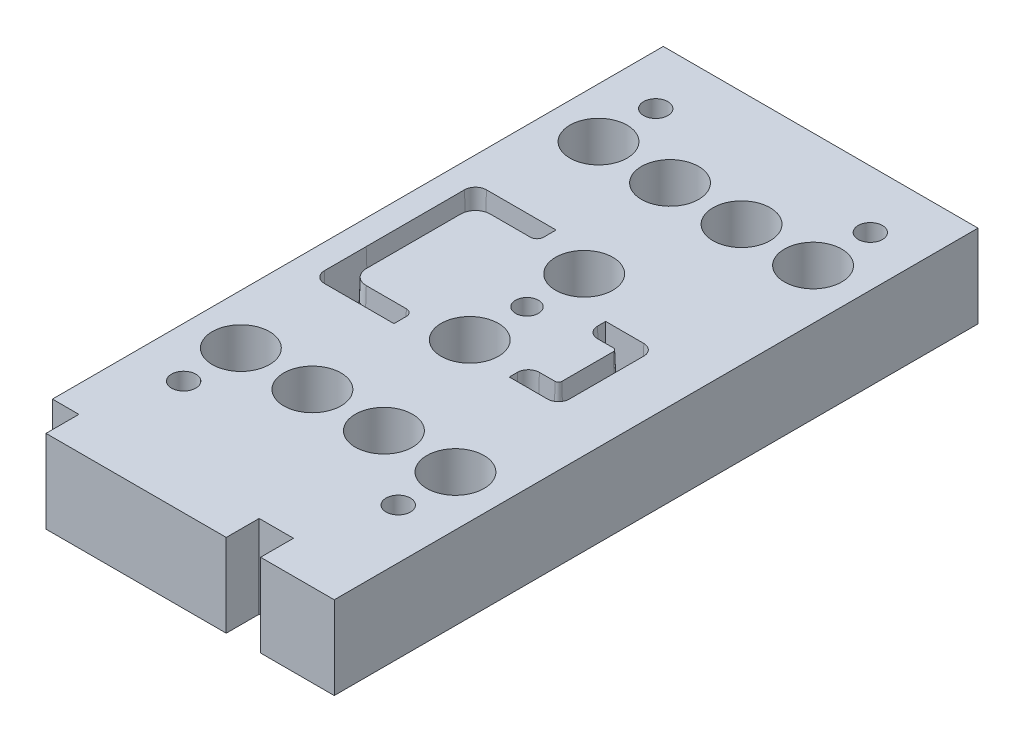
from build123d import *

# Parameters (mm, degrees)
SKETCH1_W           = 110
SKETCH1_H           = 225
BOSS_EXTRUDE1_DEPTH = 29
CUT_EXTRUDE1_REACH  = 130.539
CUT_EXTRUDE2_REACH  = 130.539
SKETCH4_R           = 8.5
CUT_EXTRUDE3_DEPTH  = 5
SKETCH5_R           = 10
CUT_EXTRUDE4_DEPTH  = 20
CUT_EXTRUDE5_REACH  = 130.539
SKETCH6_W           = 12
SKETCH6_H           = 11.5
M10_TAPPED_HOLE1_D  = 8.5
CUT_EXTRUDE6_REACH  = 130.539
SKETCH10_R          = 4


with BuildPart() as part:
    # Sketch1 → Boss-Extrude1 (new body)
    with BuildSketch(Plane(origin=(0, 0, 0), x_dir=(1, 0, 0), z_dir=(0, 1, 0))):
        Rectangle(SKETCH1_W, SKETCH1_H)
    extrude(amount=-BOSS_EXTRUDE1_DEPTH)

    # Sketch2 → Cut-Extrude1 (cut, up to next)
    with BuildSketch(Plane(origin=(0, 0, 0), x_dir=(1, 0, 0), z_dir=(0, 1, 0)), mode=Mode.PRIVATE) as cut_extrude1_sk1:
        with BuildLine():
            Line((-19, 37.36), (-19, 33.86))
            ThreePointArc((-19, 33.86), (-19.439339828, 32.799339828), (-20.5, 32.36))
            Line((-20.5, 32.36), (-34.5, 32.36))
            ThreePointArc((-34.5, 32.36), (-38.742640687, 30.602640687), (-40.5, 26.36))
            Line((-40.5, 26.36), (-40.5, -6.64))
            ThreePointArc((-40.5, -6.64), (-38.742640687, -10.882640687), (-34.5, -12.64))
            Line((-34.5, -12.64), (-20.5, -12.64))
            ThreePointArc((-20.5, -12.64), (-19.439339828, -13.079339828), (-19, -14.14))
            Line((-19, -14.14), (-19, -17.64))
            Line((-19, -17.64), (-42.5, -17.64))
            ThreePointArc((-42.5, -17.64), (-44.621320344, -16.761320344), (-45.5, -14.64))
            Line((-45.5, -14.64), (-45.5, 34.36))
            ThreePointArc((-45.5, 34.36), (-44.621320344, 36.481320344), (-42.5, 37.36))
            Line((-42.5, 37.36), (-19, 37.36))
        make_face()
    cut_extrude1_tool1 = extrude(cut_extrude1_sk1.sketch, amount=-CUT_EXTRUDE1_REACH, mode=Mode.PRIVATE) & part.part
    add(cut_extrude1_tool1.solids().sort_by_distance((-19.610512, 0, -35.61))[0], mode=Mode.SUBTRACT)

    # Sketch3 → Cut-Extrude2 (cut, up to next)
    with BuildSketch(Plane(origin=(0, 0, 0), x_dir=(1, 0, 0), z_dir=(0, 1, 0)), mode=Mode.PRIVATE) as cut_extrude2_sk1:
        with BuildLine():
            Line((19, 18.36), (31.5, 18.36))
            ThreePointArc((31.5, 18.36), (33.621320344, 17.481320344), (34.5, 15.36))
            Line((34.5, 15.36), (34.5, -10.64))
            ThreePointArc((34.5, -10.64), (33.621320344, -12.761320344), (31.5, -13.64))
            Line((31.5, -13.64), (19, -13.64))
            Line((19, -13.64), (19, -11.64))
            ThreePointArc((19, -11.64), (19.878679656, -9.518679656), (22, -8.64))
            Line((22, -8.64), (27.5, -8.64))
            ThreePointArc((27.5, -8.64), (28.914213562, -8.054213562), (29.5, -6.64))
            Line((29.5, -6.64), (29.5, 11.36))
            ThreePointArc((29.5, 11.36), (28.914213562, 12.774213562), (27.5, 13.36))
            Line((27.5, 13.36), (22, 13.36))
            ThreePointArc((22, 13.36), (19.878679656, 14.238679656), (19, 16.36))
            Line((19, 16.36), (19, 18.36))
        make_face()
    cut_extrude2_tool1 = extrude(cut_extrude2_sk1.sketch, amount=-CUT_EXTRUDE2_REACH, mode=Mode.PRIVATE) & part.part
    add(cut_extrude2_tool1.solids().sort_by_distance((25.25, 0, -18.004437))[0], mode=Mode.SUBTRACT)

    # Sketch4 → Cut-Extrude3 (cut)
    with BuildSketch(Plane.XZ.offset(29)):
        with Locations(Location((0, 100, 0), (0, 0, 270))):
            Circle(SKETCH4_R)
        with Locations(Location((0, -100, 0), (0, 0, 270))):
            Circle(SKETCH4_R)
    extrude(amount=-CUT_EXTRUDE3_DEPTH, mode=Mode.SUBTRACT)

    # Sketch5 → Cut-Extrude4 (cut)
    with BuildSketch(Plane(origin=(0, 0, 0), x_dir=(1, 0, 0), z_dir=(0, 1, 0))):
        with Locations(Location((-37.5, 72.36, 0), (0, 0, 270))):
            Circle(SKETCH5_R)
        with Locations(Location((-12.5, 72.36, 0), (0, 0, 270))):
            Circle(SKETCH5_R)
        with Locations(Location((12.5, 72.36, 0), (0, 0, 270))):
            Circle(SKETCH5_R)
        with Locations(Location((37.5, 72.36, 0), (0, 0, 270))):
            Circle(SKETCH5_R)
        with Locations(Location((37.5, -52.64, 0), (0, 0, 90))):
            Circle(SKETCH5_R)
        with Locations(Location((12.5, -52.64, 0), (0, 0, 90))):
            Circle(SKETCH5_R)
        with Locations(Location((-12.5, -52.64, 0), (0, 0, 90))):
            Circle(SKETCH5_R)
        with Locations(Location((-37.5, -52.64, 0), (0, 0, 90))):
            Circle(SKETCH5_R)
        with Locations(Location((0, 29.86, 0), (0, 0, 270))):
            Circle(SKETCH5_R)
        with Locations(Location((0, -10.14, 0), (0, 0, 270))):
            Circle(SKETCH5_R)
    extrude(amount=-CUT_EXTRUDE4_DEPTH, mode=Mode.SUBTRACT)

    # Sketch6 → Cut-Extrude5 (cut, up to next)
    with BuildSketch(Plane(origin=(0, 0, 0), x_dir=(1, 0, 0), z_dir=(0, 1, 0)), mode=Mode.PRIVATE) as cut_extrude5_sk1:
        with Locations((23.25, -106.75)):
            Rectangle(SKETCH6_W, SKETCH6_H)
    cut_extrude5_tool1 = extrude(cut_extrude5_sk1.sketch, amount=-CUT_EXTRUDE5_REACH, mode=Mode.PRIVATE) & part.part
    # Sketch6 → Cut-Extrude5 (cut, up to next)
    with BuildSketch(Plane(origin=(0, 0, 0), x_dir=(1, 0, 0), z_dir=(0, 1, 0)), mode=Mode.PRIVATE) as cut_extrude5_sk2:
        with Locations((-51.75, -106.75)):
            Rectangle(SKETCH6_W, SKETCH6_H)
    cut_extrude5_tool2 = extrude(cut_extrude5_sk2.sketch, amount=-CUT_EXTRUDE5_REACH, mode=Mode.PRIVATE) & part.part
    add(cut_extrude5_tool1.solids().sort_by_distance((23.25, 0, 106.75))[0], mode=Mode.SUBTRACT)
    add(cut_extrude5_tool2.solids().sort_by_distance((-51.75, 0, 106.75))[0], mode=Mode.SUBTRACT)

    # M10 Tapped Hole1 (through all)
    with Locations(Plane(origin=(0, 0, 0), x_dir=(1, 0, 0), z_dir=(0, 1, 0))):
        with Locations((-37.5, -72.64), (37.5, -72.64), (37.5, 92.36), (-37.5, 92.36)):
            Hole(M10_TAPPED_HOLE1_D / 2)

    # Sketch10 → Cut-Extrude6 (cut, up to next)
    with BuildSketch(Plane(origin=(0, 0, 0), x_dir=(1, 0, 0), z_dir=(0, 1, 0)), mode=Mode.PRIVATE) as cut_extrude6_sk1:
        with Locations(Location((0, 9.86, 0), (0, 0, 270))):
            Circle(SKETCH10_R)
    cut_extrude6_tool1 = extrude(cut_extrude6_sk1.sketch, amount=-CUT_EXTRUDE6_REACH, mode=Mode.PRIVATE) & part.part
    add(cut_extrude6_tool1.solids().sort_by_distance((0, 0, -9.86))[0], mode=Mode.SUBTRACT)

    # Cut-Sweep1: sweep along a path in Sketch12
    with BuildLine(Plane(origin=(0, 0, 0), x_dir=(1, 0, 0), z_dir=(0, 1, 0))) as cut_sweep1_path:
        Line((-19, 33.86), (-19, 37.36))
        Line((-19, 37.36), (-42.5, 37.36))
        ThreePointArc((-42.5, 37.36), (-44.621320344, 36.481320344), (-45.5, 34.36))
        Line((-45.5, 34.36), (-45.5, -14.64))
        ThreePointArc((-45.5, -14.64), (-44.621320344, -16.761320344), (-42.5, -17.64))
        Line((-42.5, -17.64), (-19, -17.64))
        Line((-19, -17.64), (-19, -14.14))
        ThreePointArc((-19, -14.14), (-19.439339828, -13.079339828), (-20.5, -12.64))
        Line((-20.5, -12.64), (-34.5, -12.64))
        ThreePointArc((-34.5, -12.64), (-38.742640687, -10.882640687), (-40.5, -6.64))
        Line((-40.5, -6.64), (-40.5, 26.36))
        ThreePointArc((-40.5, 26.36), (-38.742640687, 30.602640687), (-34.5, 32.36))
        Line((-34.5, 32.36), (-20.5, 32.36))
        ThreePointArc((-20.5, 32.36), (-19.439339828, 32.799339828), (-19, 33.86))
    # Sketch11 → Cut-Sweep1 (sweep, cut)
    with BuildSketch(Plane.XY):
        Polygon((-45.5, -24), (-45.5, 0), (-46.338098468, 0), align=None)
    sweep(path=cut_sweep1_path.line, transition=Transition.RIGHT, mode=Mode.SUBTRACT)

    # Cut-Sweep2: sweep along a path in Sketch14
    with BuildLine(Plane(origin=(0, 0, 0), x_dir=(1, 0, 0), z_dir=(0, 1, 0))) as cut_sweep2_path:
        Line((19, -11.64), (19, -13.64))
        Line((19, -13.64), (31.5, -13.64))
        ThreePointArc((31.5, -13.64), (33.621320344, -12.761320344), (34.5, -10.64))
        Line((34.5, -10.64), (34.5, 15.36))
        ThreePointArc((34.5, 15.36), (33.621320344, 17.481320344), (31.5, 18.36))
        Line((31.5, 18.36), (19, 18.36))
        Line((19, 18.36), (19, 16.36))
        ThreePointArc((19, 16.36), (19.878679656, 14.238679656), (22, 13.36))
        Line((22, 13.36), (27.5, 13.36))
        ThreePointArc((27.5, 13.36), (28.914213562, 12.774213562), (29.5, 11.36))
        Line((29.5, 11.36), (29.5, -6.64))
        ThreePointArc((29.5, -6.64), (28.914213562, -8.054213562), (27.5, -8.64))
        Line((27.5, -8.64), (22, -8.64))
        ThreePointArc((22, -8.64), (19.878679656, -9.518679656), (19, -11.64))
    # Sketch13 → Cut-Sweep2 (sweep, cut)
    with BuildSketch(Plane.XY):
        Polygon((34.5, -24), (34.5, 0), (35.338098468, 0), align=None)
    sweep(path=cut_sweep2_path.line, transition=Transition.RIGHT, mode=Mode.SUBTRACT)


solid = part.part
